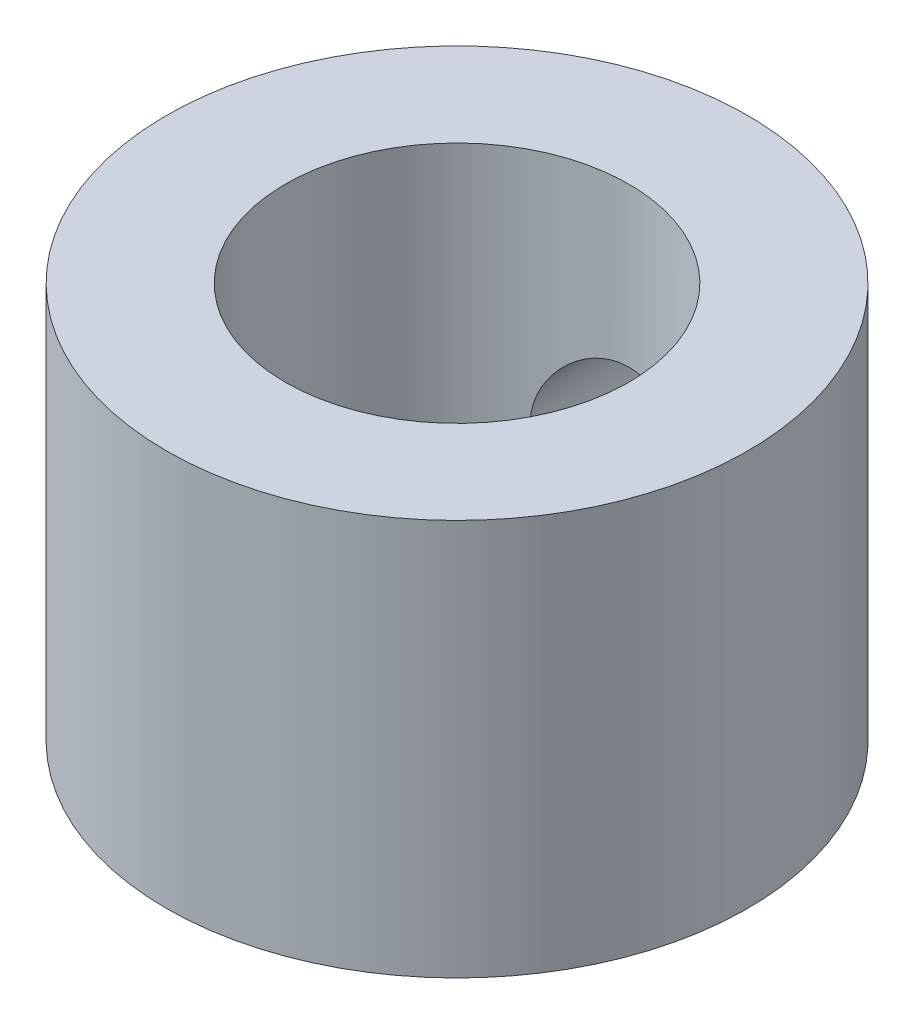
from build123d import *

# Parameters (mm, degrees)
SKETCH_1_R          = 11
SKETCH_1_R_2        = 6.5
EXTRUDE_1_DEPTH     = 15
SKETCH_2_R          = 3
CUT_EXTRUDE_1_DEPTH = 22.610182785


with BuildPart() as part:
    # Эскиз1 → Бобышка-Вытянуть1 (new body)
    with BuildSketch(Plane(origin=(0, 0, 0), x_dir=(1, 0, 0), z_dir=(0, 1, 0))):
        with Locations(Location((0, 0, 0), (0, 0, 270))):
            Circle(SKETCH_1_R)
        with Locations(Location((0, 0, 0), (0, 0, 270))):
            Circle(SKETCH_1_R_2, mode=Mode.SUBTRACT)
    extrude(amount=EXTRUDE_1_DEPTH)

    # Эскиз2 → Вырез-Вытянуть1 (cut, through all)
    with BuildSketch(Plane.XY):
        with Locations(Location((0, 6, 0), (0, 0, 90))):
            Circle(SKETCH_2_R)
    extrude(amount=-CUT_EXTRUDE_1_DEPTH, mode=Mode.SUBTRACT)


solid = part.part
